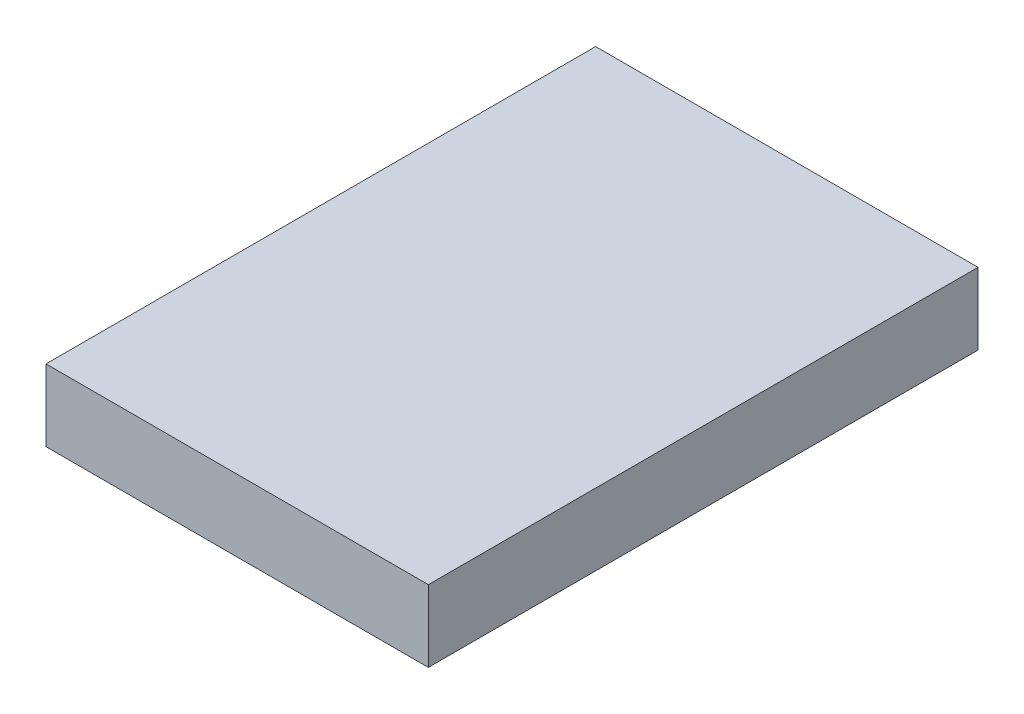
from build123d import *

# Parameters (mm, degrees)
SKETCH2_W           = 101.6
SKETCH2_H           = 146.05
BOSS_EXTRUDE1_DEPTH = 19.05


with BuildPart() as part:
    # Sketch2 → Boss-Extrude1 (new body)
    with BuildSketch(Plane(origin=(0, 0, 0), x_dir=(1, 0, 0), z_dir=(0, 1, 0))):
        with Locations((50.8, 73.025)):
            Rectangle(SKETCH2_W, SKETCH2_H)
    extrude(amount=BOSS_EXTRUDE1_DEPTH)


solid = part.part
